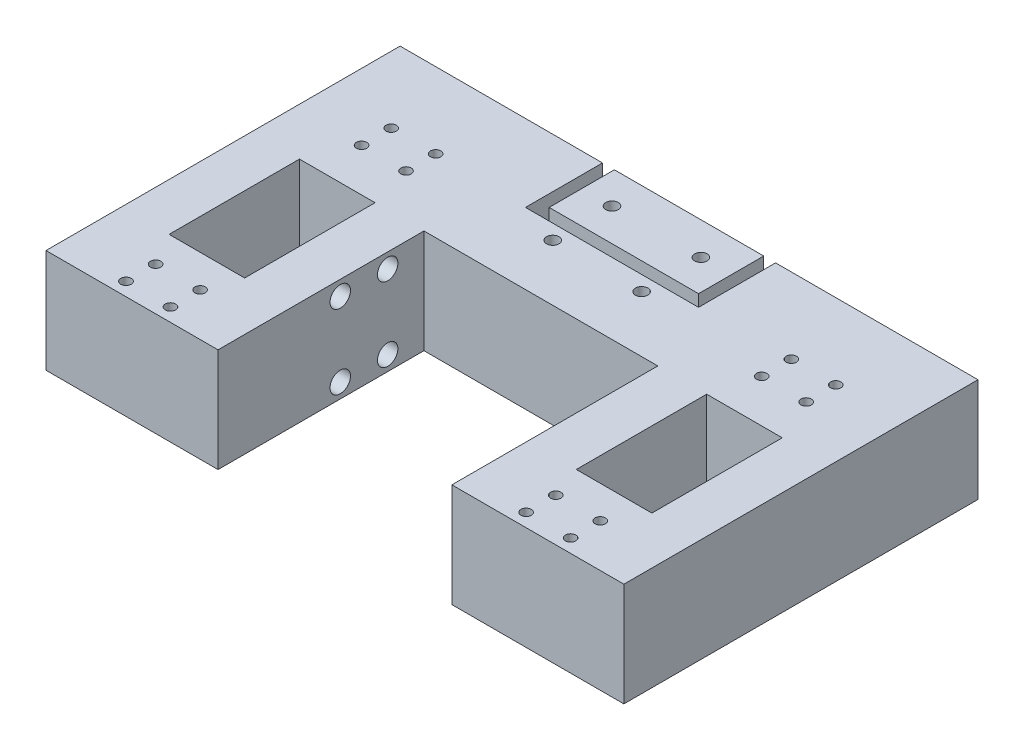
from build123d import *

# Parameters (mm, degrees)
SKETCH1_W           = 195
SKETCH1_H           = 50
BOSS_EXTRUDE1_DEPTH = 35
BOSS_EXTRUDE4_DEPTH = 35
CUT_EXTRUDE5_REACH  = 142.211
SKETCH11_R          = 1.75
SKETCH5_R           = 2.1
CUT_EXTRUDE6_DEPTH  = 6
CUT_EXTRUDE7_DEPTH  = 27
SKETCH12_R          = 3.45
CUT_EXTRUDE8_DEPTH  = 12


with BuildPart() as part:
    # Sketch1 → Boss-Extrude1 (new body)
    with BuildSketch(Plane(origin=(0, 0, 0), x_dir=(1, 0, 0), z_dir=(0, 1, 0))):
        Rectangle(SKETCH1_W, SKETCH1_H)
    extrude(amount=BOSS_EXTRUDE1_DEPTH)

    # Sketch8 → Boss-Extrude4 (add)
    with BuildSketch(Plane(origin=(0, 0, 0), x_dir=(1, 0, 0), z_dir=(0, 1, 0))):
        Polygon((55.952478692, -69), (55.952478692, -25), (39.452478692, -25), (39.452478692, -94.486788844), (97.5, -94.486788844), (97.5, -25), (81.452478692, -25), (81.452478692, -69), align=None)
    boss_extrude4 = extrude(amount=BOSS_EXTRUDE4_DEPTH)

    # Sketch11 → Cut-Extrude5 (cut, up to next)
    with BuildSketch(Plane(origin=(0, 0, 0), x_dir=(1, 0, 0), z_dir=(0, 1, 0)), mode=Mode.PRIVATE) as cut_extrude5_sk1:
        with Locations(Location((75.005806844, -0.5, 0), (0, 0, 270))):
            Circle(SKETCH11_R)
    cut_extrude5_tool1 = extrude(cut_extrude5_sk1.sketch, amount=CUT_EXTRUDE5_REACH, mode=Mode.PRIVATE) & part.part
    # Sketch11 → Cut-Extrude5 (cut, up to next)
    with BuildSketch(Plane(origin=(0, 0, 0), x_dir=(1, 0, 0), z_dir=(0, 1, 0)), mode=Mode.PRIVATE) as cut_extrude5_sk2:
        with Locations(Location((60.005806844, -0.5, 0), (0, 0, 270))):
            Circle(SKETCH11_R)
    cut_extrude5_tool2 = extrude(cut_extrude5_sk2.sketch, amount=CUT_EXTRUDE5_REACH, mode=Mode.PRIVATE) & part.part
    # Sketch11 → Cut-Extrude5 (cut, up to next)
    with BuildSketch(Plane(origin=(0, 0, 0), x_dir=(1, 0, 0), z_dir=(0, 1, 0)), mode=Mode.PRIVATE) as cut_extrude5_sk3:
        with Locations(Location((60.005806844, -10.5, 0), (0, 0, 270))):
            Circle(SKETCH11_R)
    cut_extrude5_tool3 = extrude(cut_extrude5_sk3.sketch, amount=CUT_EXTRUDE5_REACH, mode=Mode.PRIVATE) & part.part
    # Sketch11 → Cut-Extrude5 (cut, up to next)
    with BuildSketch(Plane(origin=(0, 0, 0), x_dir=(1, 0, 0), z_dir=(0, 1, 0)), mode=Mode.PRIVATE) as cut_extrude5_sk4:
        with Locations(Location((75.005806844, -10.5, 0), (0, 0, 270))):
            Circle(SKETCH11_R)
    cut_extrude5_tool4 = extrude(cut_extrude5_sk4.sketch, amount=CUT_EXTRUDE5_REACH, mode=Mode.PRIVATE) & part.part
    # Sketch11 → Cut-Extrude5 (cut, up to next)
    with BuildSketch(Plane(origin=(0, 0, 0), x_dir=(1, 0, 0), z_dir=(0, 1, 0)), mode=Mode.PRIVATE) as cut_extrude5_sk5:
        with Locations(Location((75.005806844, -79.986788844, 0), (0, 0, 270))):
            Circle(SKETCH11_R)
    cut_extrude5_tool5 = extrude(cut_extrude5_sk5.sketch, amount=CUT_EXTRUDE5_REACH, mode=Mode.PRIVATE) & part.part
    # Sketch11 → Cut-Extrude5 (cut, up to next)
    with BuildSketch(Plane(origin=(0, 0, 0), x_dir=(1, 0, 0), z_dir=(0, 1, 0)), mode=Mode.PRIVATE) as cut_extrude5_sk6:
        with Locations(Location((75.005806844, -89.986788844, 0), (0, 0, 270))):
            Circle(SKETCH11_R)
    cut_extrude5_tool6 = extrude(cut_extrude5_sk6.sketch, amount=CUT_EXTRUDE5_REACH, mode=Mode.PRIVATE) & part.part
    # Sketch11 → Cut-Extrude5 (cut, up to next)
    with BuildSketch(Plane(origin=(0, 0, 0), x_dir=(1, 0, 0), z_dir=(0, 1, 0)), mode=Mode.PRIVATE) as cut_extrude5_sk7:
        with Locations(Location((60.005806844, -79.986788844, 0), (0, 0, 270))):
            Circle(SKETCH11_R)
    cut_extrude5_tool7 = extrude(cut_extrude5_sk7.sketch, amount=CUT_EXTRUDE5_REACH, mode=Mode.PRIVATE) & part.part
    # Sketch11 → Cut-Extrude5 (cut, up to next)
    with BuildSketch(Plane(origin=(0, 0, 0), x_dir=(1, 0, 0), z_dir=(0, 1, 0)), mode=Mode.PRIVATE) as cut_extrude5_sk8:
        with Locations(Location((60.005806844, -89.986788844, 0), (0, 0, 270))):
            Circle(SKETCH11_R)
    cut_extrude5_tool8 = extrude(cut_extrude5_sk8.sketch, amount=CUT_EXTRUDE5_REACH, mode=Mode.PRIVATE) & part.part
    cut_extrude5_1 = cut_extrude5_tool1.solids().sort_by_distance((75.005807, 0, 0.5))[0]
    add(cut_extrude5_1, mode=Mode.SUBTRACT)
    cut_extrude5_2 = cut_extrude5_tool2.solids().sort_by_distance((60.005807, 0, 0.5))[0]
    add(cut_extrude5_2, mode=Mode.SUBTRACT)
    cut_extrude5_3 = cut_extrude5_tool3.solids().sort_by_distance((60.005807, 0, 10.5))[0]
    add(cut_extrude5_3, mode=Mode.SUBTRACT)
    cut_extrude5_4 = cut_extrude5_tool4.solids().sort_by_distance((75.005807, 0, 10.5))[0]
    add(cut_extrude5_4, mode=Mode.SUBTRACT)
    cut_extrude5_5 = cut_extrude5_tool5.solids().sort_by_distance((75.005807, 0, 79.986789))[0]
    add(cut_extrude5_5, mode=Mode.SUBTRACT)
    cut_extrude5_6 = cut_extrude5_tool6.solids().sort_by_distance((75.005807, 0, 89.986789))[0]
    add(cut_extrude5_6, mode=Mode.SUBTRACT)
    cut_extrude5_7 = cut_extrude5_tool7.solids().sort_by_distance((60.005807, 0, 79.986789))[0]
    add(cut_extrude5_7, mode=Mode.SUBTRACT)
    cut_extrude5_8 = cut_extrude5_tool8.solids().sort_by_distance((60.005807, 0, 89.986789))[0]
    add(cut_extrude5_8, mode=Mode.SUBTRACT)
    cut_extrude5 = cut_extrude5_1 + cut_extrude5_2 + cut_extrude5_3 + cut_extrude5_4 + cut_extrude5_5 + cut_extrude5_6 + cut_extrude5_7 + cut_extrude5_8  # Cut-Extrude5 as one shape, for the pattern or mirror that repeats it

    # Mirror2: Boss-Extrude4, Cut-Extrude5 across plane
    add(boss_extrude4.mirror(Plane(origin=(0, 0, 0), x_dir=(0, 0, 1), z_dir=(1, 0, 0))))
    add(cut_extrude5.mirror(Plane(origin=(0, 0, 0), x_dir=(0, 0, 1), z_dir=(1, 0, 0))), mode=Mode.SUBTRACT)

    # Sketch5 → Cut-Extrude6 (cut)
    with BuildSketch(Plane(origin=(0, 35, 0), x_dir=(1, 0, 0), z_dir=(0, 1, 0))):
        with Locations(Location((15, 14, 0), (0, 0, 270))):
            Circle(SKETCH5_R)
        with Locations(Location((-15, 14, 0), (0, 0, 270))):
            Circle(SKETCH5_R)
        with Locations(Location((-15, -6, 0), (0, 0, 270))):
            Circle(SKETCH5_R)
        with Locations(Location((15, -6, 0), (0, 0, 270))):
            Circle(SKETCH5_R)
    extrude(amount=-CUT_EXTRUDE6_DEPTH, mode=Mode.SUBTRACT)

    # Sketch15 → Cut-Extrude7 (cut)
    with BuildSketch(Plane(origin=(0, 35, 0), x_dir=(1, 0, 0), z_dir=(0, 1, 0))):
        Polygon((-29.2, 25), (-29.2, -1), (29.2, -1), (29.2, 25), (25.2, 25), (25.2, 21), (25.2, 3), (-25.2, 3), (-25.2, 21), (-25.2, 25), align=None)
    extrude(amount=-CUT_EXTRUDE7_DEPTH, mode=Mode.SUBTRACT)

    # Sketch12 → Cut-Extrude8 (cut)
    with BuildSketch(Plane.ZY.offset(-39.452478692)):
        with Locations((53.243394422, 30)):
            Circle(SKETCH12_R)
        with Locations((37.243394422, 30)):
            Circle(SKETCH12_R)
        with Locations((53.243394422, 5)):
            Circle(SKETCH12_R)
        with Locations((37.243394422, 5)):
            Circle(SKETCH12_R)
    cut_extrude8 = extrude(amount=-CUT_EXTRUDE8_DEPTH, mode=Mode.SUBTRACT)

    # Mirror3: Cut-Extrude8 across plane
    add(cut_extrude8.mirror(Plane(origin=(0, 0, 0), x_dir=(0, 0, 1), z_dir=(1, 0, 0))), mode=Mode.SUBTRACT)


solid = part.part
